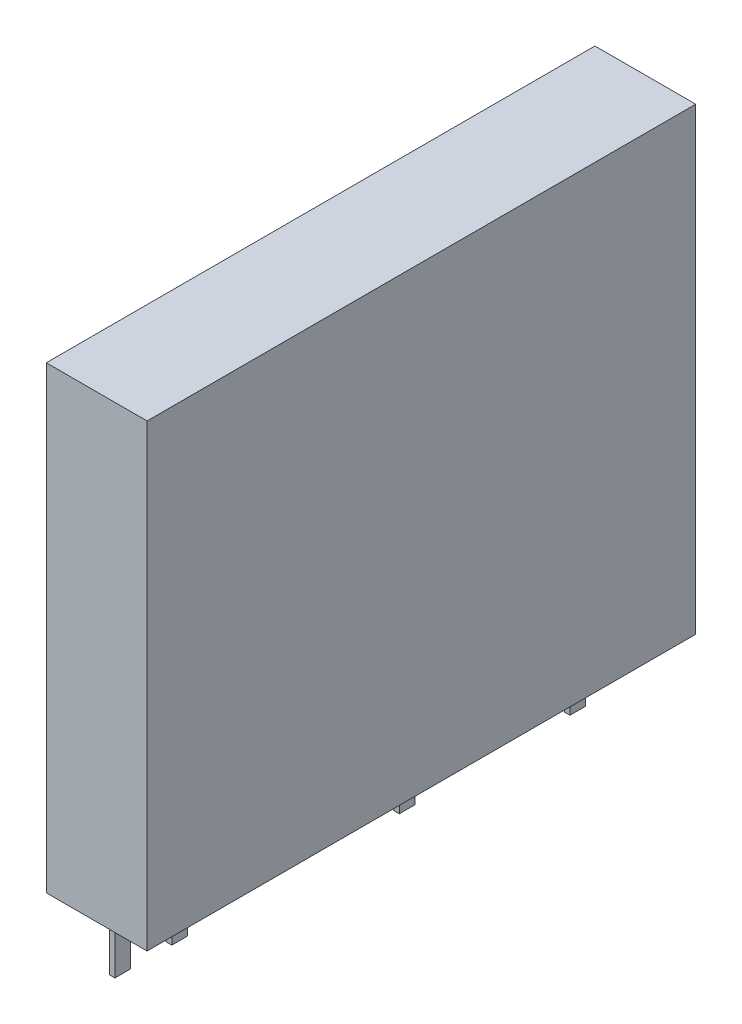
from build123d import *

# Parameters (mm, degrees)
SKETCH1_W           = 24.5
SKETCH1_H           = 20.5
BOSS_EXTRUDE1_DEPTH = 4.5
SKETCH2_W           = 0.25
SKETCH2_H           = 0.7
BOSS_EXTRUDE2_DEPTH = 3.5


with BuildPart() as part:
    # Sketch1 → Boss-Extrude1 (new body)
    with BuildSketch(Plane(origin=(0, 0, 0), x_dir=(0, 0, -1), z_dir=(1, 0, 0))):
        Rectangle(SKETCH1_W, SKETCH1_H)
    extrude(amount=BOSS_EXTRUDE1_DEPTH)

    # Sketch2 → Boss-Extrude2 (add)
    with BuildSketch(Plane.XZ.offset(10.25)):
        with Locations((1.2, 7.62)):
            Rectangle(SKETCH2_W, SKETCH2_H)
        with Locations((1.2, 10.16)):
            Rectangle(SKETCH2_W, SKETCH2_H)
        with Locations((1.2, -2.54)):
            Rectangle(SKETCH2_W, SKETCH2_H)
        with Locations((1.2, -10.16)):
            Rectangle(SKETCH2_W, SKETCH2_H)
    extrude(amount=BOSS_EXTRUDE2_DEPTH)


solid = part.part
